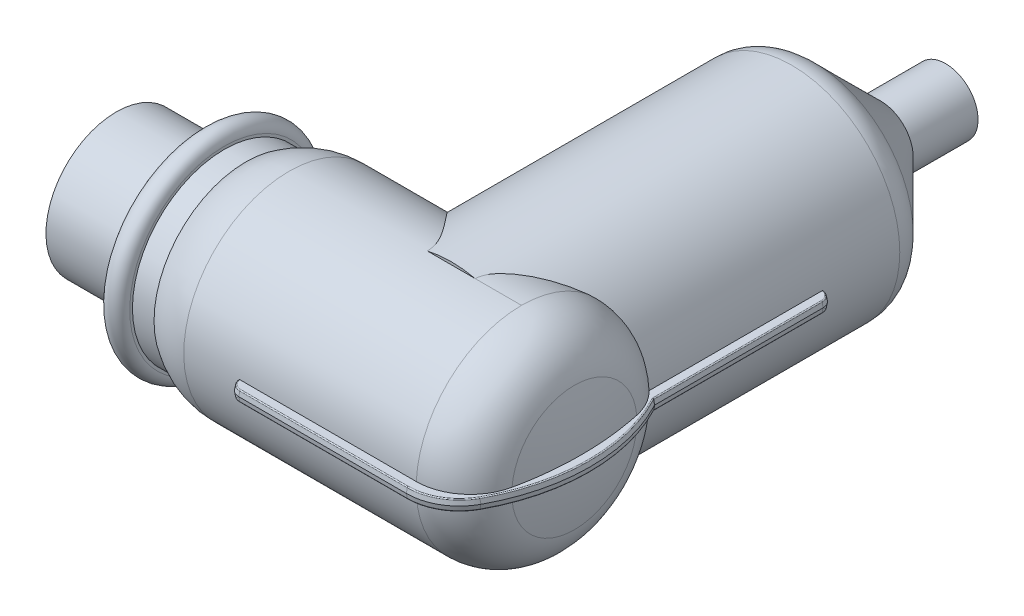
from build123d import *

# Parameters (mm, degrees)
BOSS_EXTRUDE1_DEPTH                     = 0.5
BOSS_EXTRUDE1_DRAFT                     = 10
BOSS_EXTRUDE1_PROFILE_2_DEPTH           = 0.5
BOSS_EXTRUDE1_PROFILE_2_DRAFT           = 10
BOSS_EXTRUDE1_OTHER_WAY_DEPTH           = 0.5
BOSS_EXTRUDE1_OTHER_WAY_DRAFT           = -10
BOSS_EXTRUDE1_OTHER_WAY_PROFILE_2_DEPTH = 0.5
BOSS_EXTRUDE1_OTHER_WAY_PROFILE_2_DRAFT = -10
FILLET1_R                               = 0.1


with BuildPart() as part:
    # Sketch1 → Revolve1 (revolve)
    with BuildSketch(Plane.XY):
        with BuildLine():
            Line((8, 6.5), (8, 8.75))
            ThreePointArc((8, 8.75), (9, 9.75), (10, 8.75))
            Line((10, 8.75), (10, 8.5))
            Line((10, 8.5), (12, 8.5))
            ThreePointArc((12, 8.5), (13.904618173, 9.430221846), (16, 9.75))
            Line((16, 9.75), (37.5, 9.75))
            ThreePointArc((37.5, 9.75), (40.645991143, 8.636224354), (42.390410959, 5.79109589))
            ThreePointArc((42.390410959, 5.79109589), (42.847182909, 2.911545569), (43, 0))
            Line((43, 0), (0, 0))
            Line((0, 0), (0, 6.5))
            Line((0, 6.5), (8, 6.5))
        make_face()
    revolve(axis=Axis((0, 0, 0), (-1, 0, 0)))

    # Sketch2 → Revolve2 (revolve)
    with BuildSketch(Plane(origin=(0, 0, 0), x_dir=(1, 0, 0), z_dir=(0, 1, 0)), mode=Mode.PRIVATE) as revolve2_sk:
        with BuildLine():
            Line((41, 0), (31, 0))
            Line((31, 0), (31, 45.742640687))
            Line((31, 45.742640687), (34, 45.742640687))
            Line((34, 45.742640687), (34, 39.742640687))
            Line((34, 39.742640687), (40.121320344, 33.621320344))
            ThreePointArc((40.121320344, 33.621320344), (40.771638598, 32.648050297), (41, 31.5))
            Line((41, 31.5), (41, 0))
        make_face()
    revolve(revolve2_sk.sketch.rotate(Axis((31, 0, 0), (0, 0, 1)), 180), axis=Axis((31, 0, 0), (0, 0, 1)))


with BuildPart() as boss_extrude1_tool:
    # Sketch3 → Boss-Extrude1 (with draft: the straight prism first)
    with BuildSketch(Plane(origin=(0, 0, 0), x_dir=(1, 0, 0), z_dir=(0, 1, 0))):
        with BuildLine():
            ThreePointArc((40.9, 7.660954701), (42.867294577, 0.024062034), (40.923123345, -7.61875))
            ThreePointArc((40.923123345, -7.61875), (39.490210416, -9.103962209), (37.5, -9.65))
            Line((37.5, -9.65), (21, -9.65))
            ThreePointArc((21, -9.65), (21.292893219, -10.357106781), (22, -10.65))
            Line((22, -10.65), (37.5, -10.65))
            ThreePointArc((37.5, -10.65), (40.000520779, -9.963952519), (41.80084728, -8.097916667))
            ThreePointArc((41.80084728, -8.097916667), (43.866988751, -0.104652812), (41.9, 7.913586576))
            Line((41.9, 7.913586576), (41.9, 23.5))
            ThreePointArc((41.9, 23.5), (41.607106781, 24.207106781), (40.9, 24.5))
            Line((40.9, 24.5), (40.9, 7.660954701))
        make_face()
    extrude(amount=BOSS_EXTRUDE1_DEPTH)
    # Boss-Extrude1: the draft: its side faces are tilted about the plane it starts from
    boss_extrude1_sides = [boss_extrude1_tool.faces().sort_by_distance(p)[0] for p in [
        (40.9, 0.25, -16.08047735),
        (42.867294577, 0.25, -0.024062034),
        (39.490210416, 0.25, 9.103962209),
        (29.25, 0.25, 9.65),
        (21.292893219, 0.25, 10.357106781),
        (29.75, 0.25, 10.65),
        (40.000520779, 0.25, 9.963952519),
        (43.866988751, 0.25, 0.104652812),
        (41.9, 0.25, -15.706793288),
        (41.607106781, 0.25, -24.207106781),
    ]]
    draft(boss_extrude1_sides, Plane(origin=(0, 0, 0), x_dir=(1, 0, 0), z_dir=(0, 1, 0)), BOSS_EXTRUDE1_DRAFT)


with BuildPart() as part_1:
    add(part.part)

    # Boss-Extrude1: add boss_extrude1_tool
    add(boss_extrude1_tool.part)


with BuildPart() as boss_extrude1_profile_2_tool:
    # Sketch3 → Boss-Extrude1 profile 2 (with draft: the straight prism first)
    with BuildSketch(Plane(origin=(0, 0, 0), x_dir=(1, 0, 0), z_dir=(0, 1, 0))):
        with BuildLine():
            Line((21.1, 9.65), (21.1, 24.5))
            ThreePointArc((21.1, 24.5), (20.392893219, 24.207106781), (20.1, 23.5))
            Line((20.1, 23.5), (20.1, 10.65))
            Line((20.1, 10.65), (19, 10.65))
            ThreePointArc((19, 10.65), (18.292893219, 10.357106781), (18, 9.65))
            Line((18, 9.65), (21.1, 9.65))
        make_face()
    extrude(amount=BOSS_EXTRUDE1_PROFILE_2_DEPTH)
    # Boss-Extrude1 profile 2: the draft: its side faces are tilted about the plane it starts from
    boss_extrude1_profile_2_sides = [boss_extrude1_profile_2_tool.faces().sort_by_distance(p)[0] for p in [
        (21.1, 0.25, -17.075),
        (20.392893219, 0.25, -24.207106781),
        (20.1, 0.25, -17.075),
        (19.55, 0.25, -10.65),
        (18.292893219, 0.25, -10.357106781),
        (19.55, 0.25, -9.65),
    ]]
    draft(boss_extrude1_profile_2_sides, Plane(origin=(0, 0, 0), x_dir=(1, 0, 0), z_dir=(0, 1, 0)), BOSS_EXTRUDE1_PROFILE_2_DRAFT)


with BuildPart() as part_2:
    add(part_1.part)

    # Boss-Extrude1 profile 2: add boss_extrude1_profile_2_tool
    add(boss_extrude1_profile_2_tool.part)


with BuildPart() as boss_extrude1_other_way_tool:
    # Sketch3 → Boss-Extrude1 other way (with draft: the straight prism first)
    with BuildSketch(Plane(origin=(0, 0, 0), x_dir=(1, 0, 0), z_dir=(0, 1, 0))):
        with BuildLine():
            ThreePointArc((40.9, 7.660954701), (42.867294577, 0.024062034), (40.923123345, -7.61875))
            ThreePointArc((40.923123345, -7.61875), (39.490210416, -9.103962209), (37.5, -9.65))
            Line((37.5, -9.65), (21, -9.65))
            ThreePointArc((21, -9.65), (21.292893219, -10.357106781), (22, -10.65))
            Line((22, -10.65), (37.5, -10.65))
            ThreePointArc((37.5, -10.65), (40.000520779, -9.963952519), (41.80084728, -8.097916667))
            ThreePointArc((41.80084728, -8.097916667), (43.866988751, -0.104652812), (41.9, 7.913586576))
            Line((41.9, 7.913586576), (41.9, 23.5))
            ThreePointArc((41.9, 23.5), (41.607106781, 24.207106781), (40.9, 24.5))
            Line((40.9, 24.5), (40.9, 7.660954701))
        make_face()
    extrude(amount=-BOSS_EXTRUDE1_OTHER_WAY_DEPTH)
    # Boss-Extrude1 other way: the draft: its side faces are tilted about the plane it starts from
    boss_extrude1_other_way_sides = [boss_extrude1_other_way_tool.faces().sort_by_distance(p)[0] for p in [
        (40.9, -0.25, -16.08047735),
        (42.867294577, -0.25, -0.024062034),
        (39.490210416, -0.25, 9.103962209),
        (29.25, -0.25, 9.65),
        (21.292893219, -0.25, 10.357106781),
        (29.75, -0.25, 10.65),
        (40.000520779, -0.25, 9.963952519),
        (43.866988751, -0.25, 0.104652812),
        (41.9, -0.25, -15.706793288),
        (41.607106781, -0.25, -24.207106781),
    ]]
    draft(boss_extrude1_other_way_sides, Plane(origin=(0, 0, 0), x_dir=(1, 0, 0), z_dir=(0, 1, 0)), BOSS_EXTRUDE1_OTHER_WAY_DRAFT)


with BuildPart() as part_3:
    add(part_2.part)

    # Boss-Extrude1 other way: add boss_extrude1_other_way_tool
    add(boss_extrude1_other_way_tool.part)


with BuildPart() as boss_extrude1_other_way_profile_2_tool:
    # Sketch3 → Boss-Extrude1 other way profile 2 (with draft: the straight prism first)
    with BuildSketch(Plane(origin=(0, 0, 0), x_dir=(1, 0, 0), z_dir=(0, 1, 0))):
        with BuildLine():
            Line((21.1, 9.65), (21.1, 24.5))
            ThreePointArc((21.1, 24.5), (20.392893219, 24.207106781), (20.1, 23.5))
            Line((20.1, 23.5), (20.1, 10.65))
            Line((20.1, 10.65), (19, 10.65))
            ThreePointArc((19, 10.65), (18.292893219, 10.357106781), (18, 9.65))
            Line((18, 9.65), (21.1, 9.65))
        make_face()
    extrude(amount=-BOSS_EXTRUDE1_OTHER_WAY_PROFILE_2_DEPTH)
    # Boss-Extrude1 other way profile 2: the draft: its side faces are tilted about the plane it starts from
    boss_extrude1_other_way_profile_2_sides = [boss_extrude1_other_way_profile_2_tool.faces().sort_by_distance(p)[0] for p in [
        (21.1, -0.25, -17.075),
        (20.392893219, -0.25, -24.207106781),
        (20.1, -0.25, -17.075),
        (19.55, -0.25, -10.65),
        (18.292893219, -0.25, -10.357106781),
        (19.55, -0.25, -9.65),
    ]]
    draft(boss_extrude1_other_way_profile_2_sides, Plane(origin=(0, 0, 0), x_dir=(1, 0, 0), z_dir=(0, 1, 0)), BOSS_EXTRUDE1_OTHER_WAY_PROFILE_2_DRAFT)


with BuildPart() as part_4:
    add(part_3.part)

    # Boss-Extrude1 other way profile 2: add boss_extrude1_other_way_profile_2_tool
    add(boss_extrude1_other_way_profile_2_tool.part)

    # Fillet1
    fillet1_edges = [part_4.edges().sort_by_distance(p)[0] for p in [
        (20.424782809, 0.5, -24.11280304),
        (20.424782809, -0.5, -24.11280304),
        (20.18816349, 0.5, -17.030918255),
        (20.18816349, -0.5, -17.030918255),
        (18.38719696, -0.5, -10.325217191),
        (19.594081745, 0.5, -10.56183651),
        (41.575217191, 0.5, -24.11280304),
        (21.38719696, 0.5, 10.325217191),
        (29.75, 0.5, 10.56183651),
        (39.955530036, 0.5, 9.888132772),
        (41.575217191, -0.5, -24.11280304),
        (43.778891166, -0.5, 0.093161799),
        (39.955530036, -0.5, 9.888132772),
        (29.75, -0.5, 10.56183651),
        (41.855918198, -0.250000324, -7.902620269),
        (41.855918198, 0.250000324, -7.902620269),
        (19.594081745, -0.5, -10.56183651),
        (20.144081745, -0.25, -10.605918255),
        (20.144081745, 0.25, -10.605918255),
        (18.38719696, 0.5, -10.325217191),
        (41.81183651, 0.5, -15.695819375),
        (43.778891166, 0.5, 0.093161799),
        (41.81183651, -0.5, -15.695819375),
        (21.38719696, -0.5, 10.325217191),
    ]]
    fillet(fillet1_edges, radius=FILLET1_R)


solid = part_4.part
